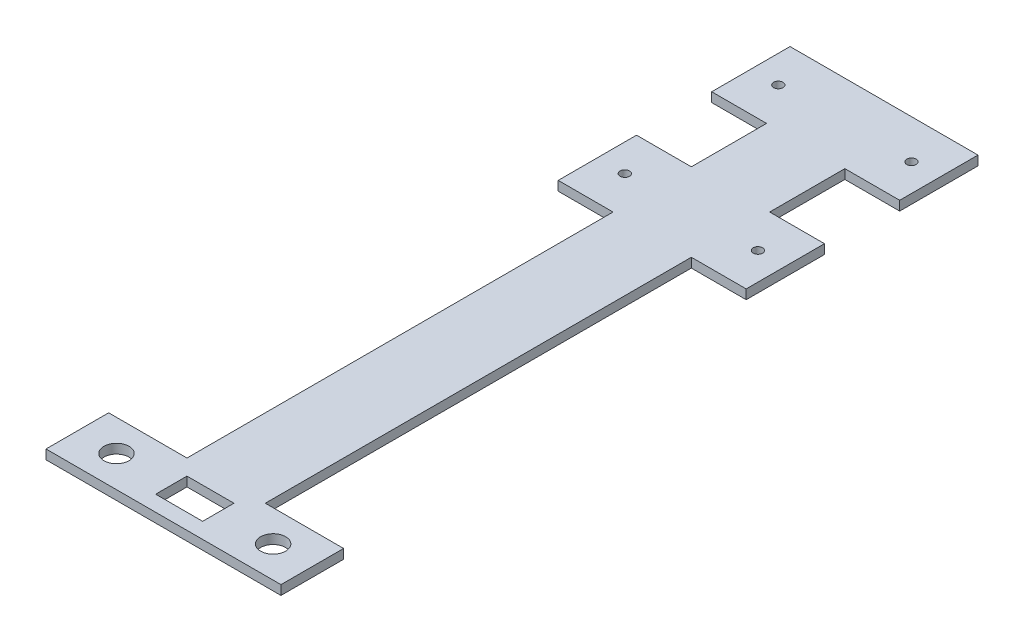
from build123d import *

# Parameters (mm, degrees)
SKETCH1_W               = 17.5
SKETCH1_H               = 25
SKETCH1_W_2             = 25
SKETCH1_H_2             = 230
SKETCH1_H_3             = 20
BOSS_EXTRUDE1_DEPTH     = 3
CUT_EXTRUDE1_DEPTH      = 121.996900787
CUT_EXTRUDE1_DEPTH_BACK = 121.996900787
SKETCH2_R               = 1.5
CUT_EXTRUDE2_DEPTH      = 121.996900787
CUT_EXTRUDE2_DEPTH_BACK = 121.996900787
SKETCH3_R               = 4
SKETCH3_W               = 15
SKETCH3_H               = 10


with BuildPart() as part:
    # Sketch1 → Boss-Extrude1 (new body)
    with BuildSketch(Plane(origin=(0, 0, 0), x_dir=(1, 0, 0), z_dir=(0, 1, 0))):
        with Locations((21.25, 53.5)):
            Rectangle(SKETCH1_W, SKETCH1_H)
        Rectangle(SKETCH1_W_2, SKETCH1_H_2)
        with Locations((-21.25, 53.5)):
            Rectangle(SKETCH1_W, SKETCH1_H)
        with Locations((21.25, 102.5)):
            Rectangle(SKETCH1_W, SKETCH1_H)
        with Locations((-21.25, 102.5)):
            Rectangle(SKETCH1_W, SKETCH1_H)
        with Locations((-25, -105)):
            Rectangle(SKETCH1_W_2, SKETCH1_H_3)
        with Locations((25, -105)):
            Rectangle(SKETCH1_W_2, SKETCH1_H_3)
    extrude(amount=BOSS_EXTRUDE1_DEPTH)

    # Sketch2 → Cut-Extrude1 (cut, two sides: drawn at the far end of the back side and taken through both)
    with BuildSketch(Plane(origin=(0, 3, 0), x_dir=(1, 0, 0), z_dir=(0, 1, 0)).offset(-CUT_EXTRUDE1_DEPTH_BACK)):
        with Locations(Location((-21.25, 102.5, 0), (0, 0, 270))):
            Circle(SKETCH2_R)
        with Locations(Location((21.25, 102.5, 0), (0, 0, 270))):
            Circle(SKETCH2_R)
        with Locations(Location((-21.25, 53.5, 0), (0, 0, 270))):
            Circle(SKETCH2_R)
        with Locations(Location((21.25, 53.5, 0), (0, 0, 270))):
            Circle(SKETCH2_R)
    extrude(amount=CUT_EXTRUDE1_DEPTH + CUT_EXTRUDE1_DEPTH_BACK, mode=Mode.SUBTRACT)

    # Sketch3 → Cut-Extrude2 (cut, two sides: drawn at the far end of the back side and taken through both)
    with BuildSketch(Plane(origin=(0, 3, 0), x_dir=(1, 0, 0), z_dir=(0, 1, 0)).offset(-CUT_EXTRUDE2_DEPTH_BACK)):
        with Locations(Location((-25, -105, 0), (0, 0, 270))):
            Circle(SKETCH3_R)
        with Locations(Location((25, -105, 0), (0, 0, 270))):
            Circle(SKETCH3_R)
        with Locations((0, -105)):
            Rectangle(SKETCH3_W, SKETCH3_H)
    extrude(amount=CUT_EXTRUDE2_DEPTH + CUT_EXTRUDE2_DEPTH_BACK, mode=Mode.SUBTRACT)


solid = part.part
